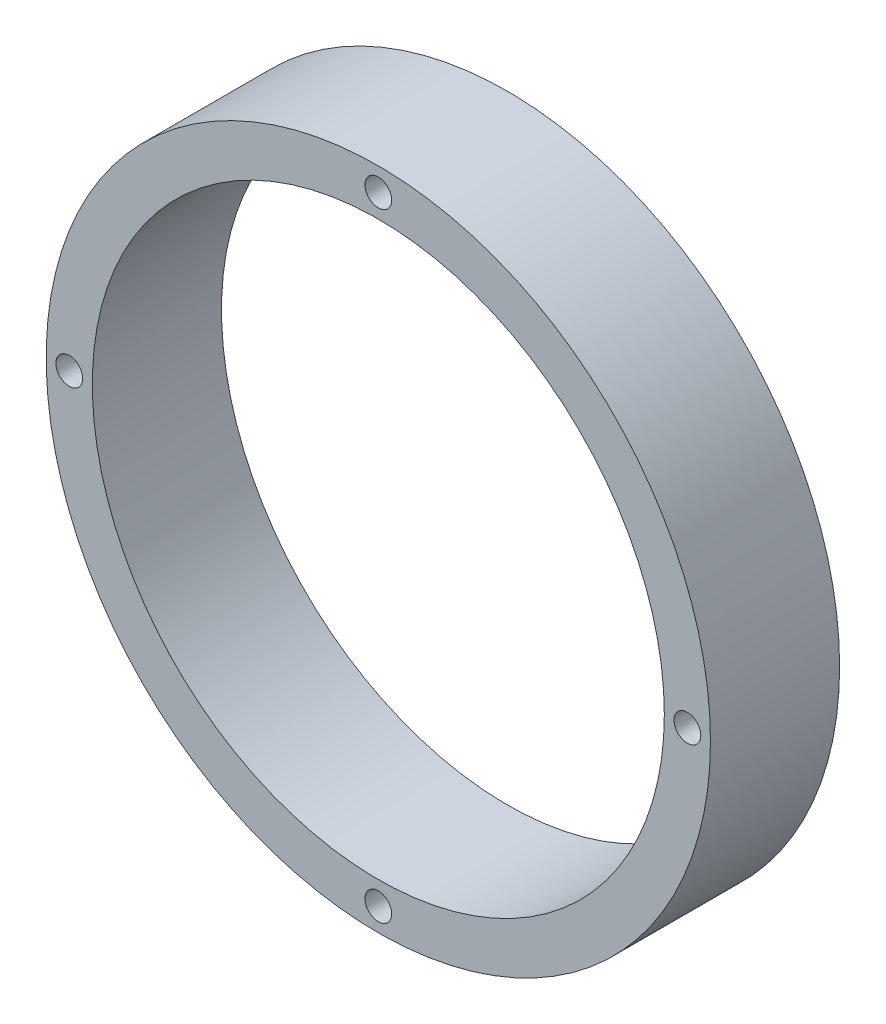
from build123d import *

# Parameters (mm, degrees)
SKETCH1_R           = 36
SKETCH1_R_2         = 31
BOSS_EXTRUDE1_DEPTH = 14
SKETCH2_R           = 1.45
CUT_EXTRUDE1_DEPTH  = 53.80151513
CIRPATTERN1_COUNT   = 4


with BuildPart() as part:
    # Sketch1 → Boss-Extrude1 (new body)
    with BuildSketch(Plane.XY):
        Circle(SKETCH1_R)
        Circle(SKETCH1_R_2, mode=Mode.SUBTRACT)
    extrude(amount=BOSS_EXTRUDE1_DEPTH)

    # Sketch2 → Cut-Extrude1 (cut, through all)
    with BuildSketch(Plane.XY.offset(14)):
        with Locations((0, 33.5)):
            Circle(SKETCH2_R)
    cut_extrude1 = extrude(amount=-CUT_EXTRUDE1_DEPTH, mode=Mode.SUBTRACT)

    # CirPattern1: Cut-Extrude1 ×4 about axis
    cirpattern1_axis = Axis((0, 0, 0), (0, 0, 1))
    for i in range(1, CIRPATTERN1_COUNT):
        add(cut_extrude1.rotate(cirpattern1_axis, i * 360 / CIRPATTERN1_COUNT), mode=Mode.SUBTRACT)


solid = part.part
